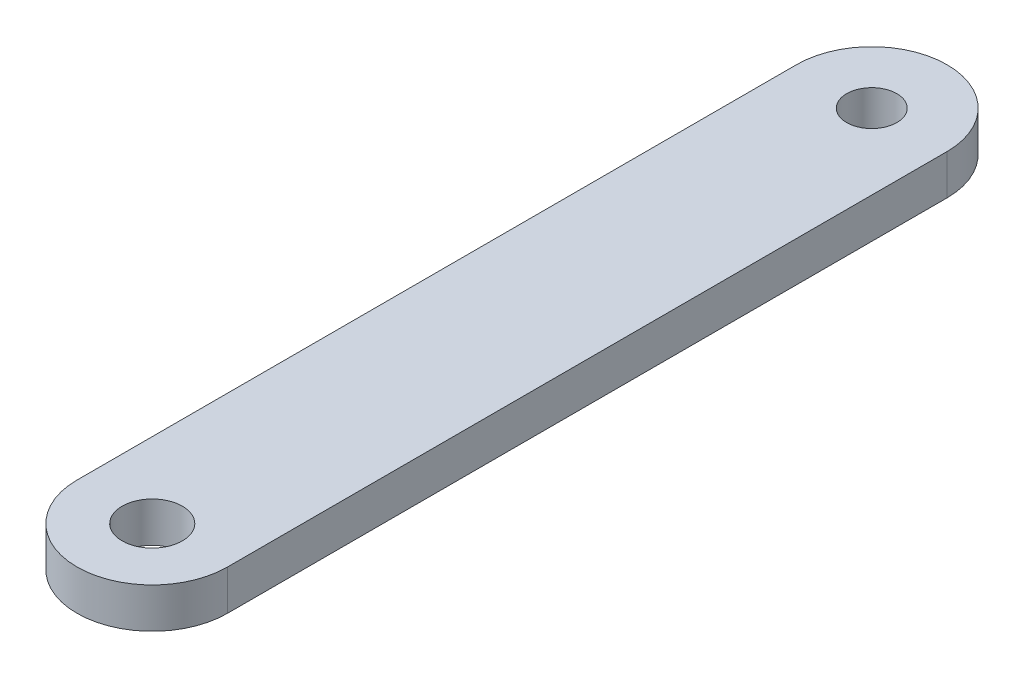
from build123d import *

# Parameters (mm, degrees)
SKETCH1_R           = 1.25
SKETCH1_R_2         = 1.5
BOSS_EXTRUDE1_DEPTH = 2


with BuildPart() as part:
    # Sketch1 → Boss-Extrude1 (new body)
    with BuildSketch(Plane(origin=(0, 0, 0), x_dir=(1, 0, 0), z_dir=(0, 1, 0))):
        with BuildLine():
            Line((-2.458792373, -4.823040254), (-2.458792373, 31.026959746))
            ThreePointArc((-2.458792373, 31.026959746), (1.291207627, 34.776959746), (5.041207627, 31.026959746))
            Line((5.041207627, 31.026959746), (5.041207627, -4.823040254))
            ThreePointArc((5.041207627, -4.823040254), (1.291207627, -8.573040254), (-2.458792373, -4.823040254))
        make_face()
        with Locations(Location((1.291207627, 31.026959746, 0), (0, 0, 270))):
            Circle(SKETCH1_R, mode=Mode.SUBTRACT)
        with Locations(Location((1.291207627, -4.823040254, 0), (0, 0, 270))):
            Circle(SKETCH1_R_2, mode=Mode.SUBTRACT)
    extrude(amount=BOSS_EXTRUDE1_DEPTH)


solid = part.part
